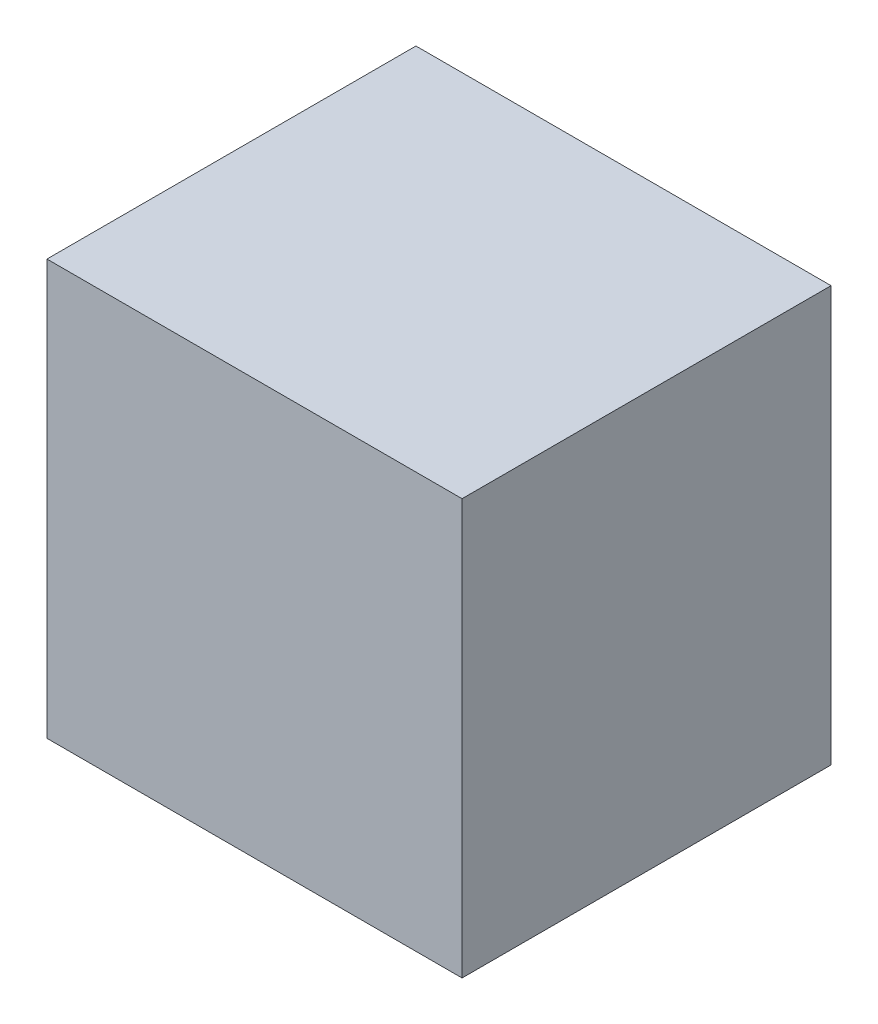
from build123d import *

# Parameters (mm, degrees)
SKETCH1_W           = 1371.6
SKETCH1_H           = 1371.6
BOSS_EXTRUDE1_DEPTH = 1219.2


with BuildPart() as part:
    # Sketch1 → Boss-Extrude1 (new body)
    with BuildSketch(Plane.XY):
        Rectangle(SKETCH1_W, SKETCH1_H)
    extrude(amount=BOSS_EXTRUDE1_DEPTH)


solid = part.part
